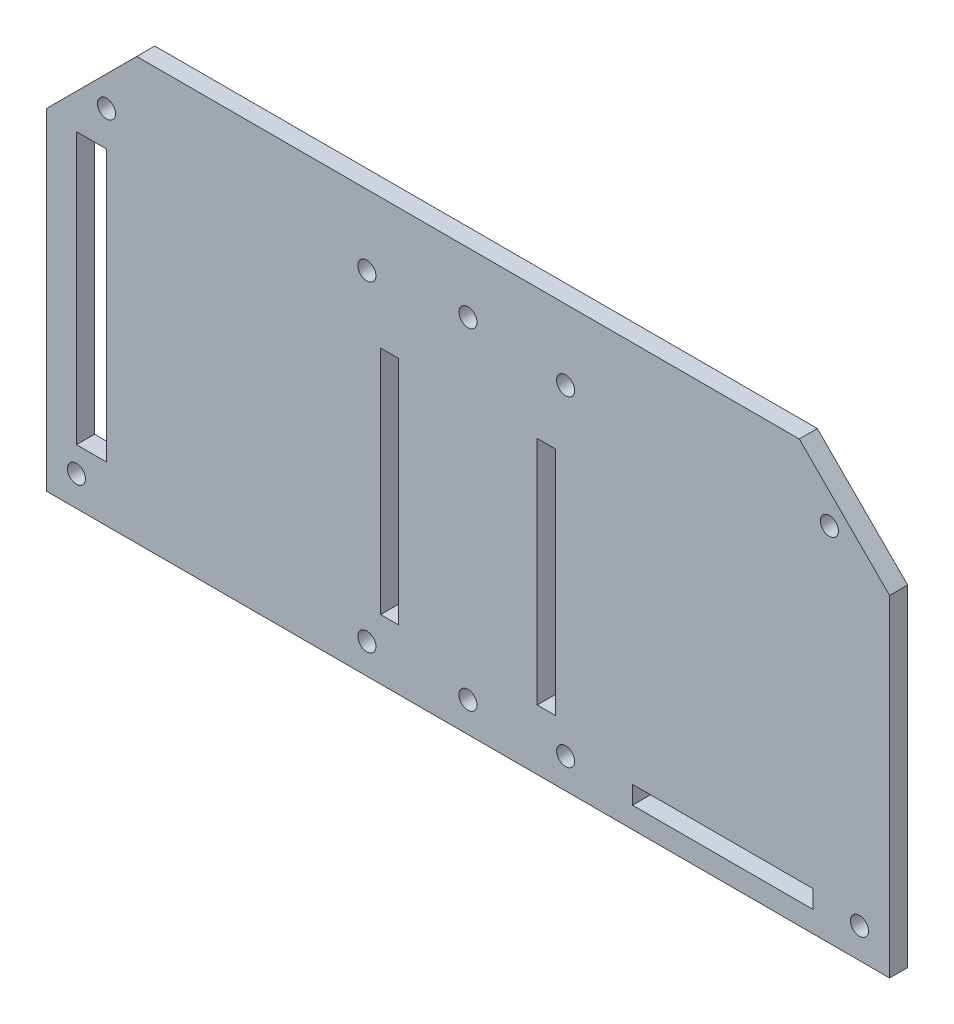
from build123d import *

# Parameters (mm, degrees)
CROQUIS2_W              = 140
CROQUIS2_H              = 70
SALIENTE_EXTRUIR1_DEPTH = 3
CROQUIS3_R              = 1.5
CORTAR_EXTRUIR1_DEPTH   = 3
CHAFL_N2_SIZE           = 15
CROQUIS4_R              = 1.5
CROQUIS4_W              = 3
CROQUIS4_H              = 38.326321521
CROQUIS4_W_2            = 30
CROQUIS4_H_2            = 3
CROQUIS4_W_3            = 5
CROQUIS4_H_3            = 45
CORTAR_EXTRUIR2_DEPTH   = 3


with BuildPart() as part:
    # Croquis2 → Saliente-Extruir1 (new body)
    with BuildSketch(Plane.XY):
        Rectangle(CROQUIS2_W, CROQUIS2_H)
    extrude(amount=SALIENTE_EXTRUIR1_DEPTH)

    # Croquis3 → Cortar-Extruir1 (cut)
    with BuildSketch(Plane.XY.offset(3)):
        with Locations((-65, -30)):
            Circle(CROQUIS3_R)
        with Locations((65, -30)):
            Circle(CROQUIS3_R)
        with Locations((0, -30)):
            Circle(CROQUIS3_R)
        with Locations((-60, 25)):
            Circle(CROQUIS3_R)
        with Locations((60, 25)):
            Circle(CROQUIS3_R)
        with Locations((0, 25)):
            Circle(CROQUIS3_R)
    extrude(amount=-CORTAR_EXTRUIR1_DEPTH, mode=Mode.SUBTRACT)

    # Chaflán2
    chafl_n2_edges = [part.edges().sort_by_distance(p)[0] for p in [
        (-70, 35, 1.5),
        (70, 35, 1.5),
    ]]
    chamfer(chafl_n2_edges, length=CHAFL_N2_SIZE)

    # Croquis4 → Cortar-Extruir2 (cut)
    with BuildSketch(Plane.XY.offset(3)):
        with Locations((-16.783900612, 23.326321521)):
            Circle(CROQUIS4_R)
        with Locations((16.216099388, 23.326321521)):
            Circle(CROQUIS4_R)
        with Locations((-16.783900612, -30)):
            Circle(CROQUIS4_R)
        with Locations((16.216099388, -30)):
            Circle(CROQUIS4_R)
        with Locations((13, -5.836839239)):
            Rectangle(CROQUIS4_W, CROQUIS4_H)
        with Locations((-13, -5.836839239)):
            Rectangle(CROQUIS4_W, CROQUIS4_H)
        with Locations((42.309397606, -30)):
            Rectangle(CROQUIS4_W_2, CROQUIS4_H_2)
        with Locations((-62.5, -3.320076901)):
            Rectangle(CROQUIS4_W_3, CROQUIS4_H_3)
    extrude(amount=-CORTAR_EXTRUIR2_DEPTH, mode=Mode.SUBTRACT)


solid = part.part
